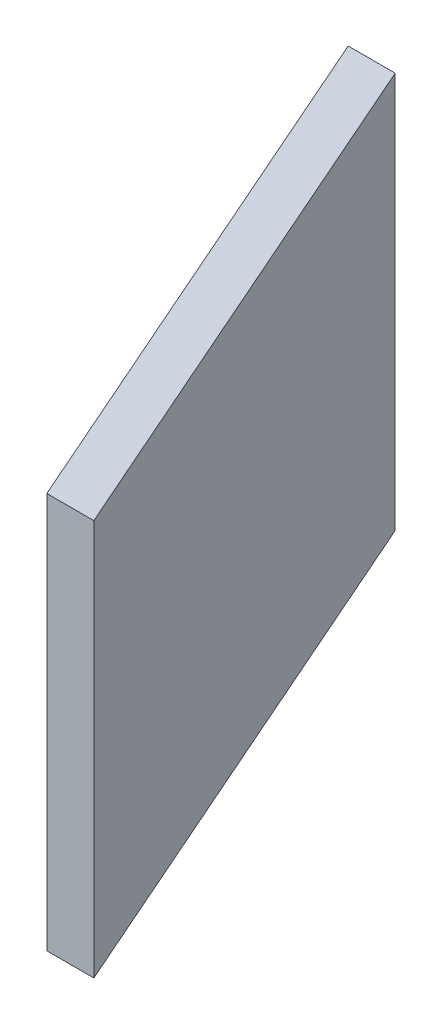
from build123d import *

# Parameters (mm, degrees)
BOSS_EXTRUDE1_DEPTH = 18.4


with BuildPart() as part:
    # Sketch1 → Boss-Extrude1 (new body)
    with BuildSketch(Plane(origin=(0, 0, 0), x_dir=(1, 0, 0), z_dir=(0, 1, 0))):
        Polygon((0, 0), (-11.000263272, 25), (-8.815214744, 25), (2.185048528, 0), align=None)
    extrude(amount=BOSS_EXTRUDE1_DEPTH)


solid = part.part
